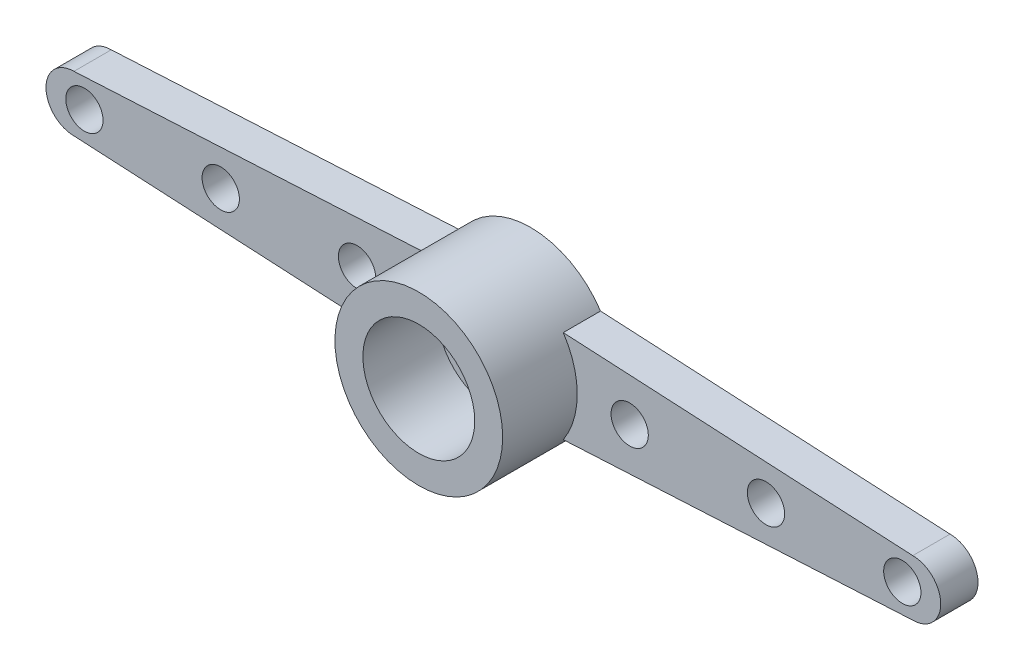
from build123d import *

# Parameters (mm, degrees)
SKETCH1_R           = 1.5
SKETCH1_R_2         = 4.5
BOSS_EXTRUDE1_DEPTH = 6
CUT_EXTRUDE1_START  = -4
SKETCH3_R           = 3
CUT_EXTRUDE1_DEPTH  = 4
SKETCH4_R           = 1
CUT_EXTRUDE2_DEPTH  = 10


with BuildPart() as part:
    # Sketch1 → Boss-Extrude1 (new body)
    with BuildSketch(Plane.XY):
        with Locations((-22.5, 0)):
            Circle(SKETCH1_R)
        with BuildLine():
            Line((-3.75, 2.487468593), (-22.5, 1.5))
            ThreePointArc((-22.5, 1.5), (-21.439339828, 1.060660172), (-21, 0))
            ThreePointArc((-21, 0), (-21.439339828, -1.060660172), (-22.5, -1.5))
            Line((-22.5, -1.5), (-3.75, -2.487468593))
            ThreePointArc((-3.75, -2.487468593), (-4.5, 0), (-3.75, 2.487468593))
        make_face()
        Circle(SKETCH1_R_2)
        with BuildLine():
            ThreePointArc((22.5, -1.5), (21, 0), (22.5, 1.5))
            Line((22.5, 1.5), (3.75, 2.487468593))
            ThreePointArc((3.75, 2.487468593), (4.308421985, 1.299038106), (4.5, 0))
            ThreePointArc((4.5, 0), (4.308421985, -1.299038106), (3.75, -2.487468593))
            Line((3.75, -2.487468593), (22.5, -1.5))
        make_face()
        with Locations((22.5, 0)):
            Circle(SKETCH1_R)
    extrude(amount=BOSS_EXTRUDE1_DEPTH)

    # Sketch3 → Cut-Extrude1 (cut)
    with BuildSketch(Plane.XY.offset(6).offset(CUT_EXTRUDE1_START)):
        with BuildLine():
            ThreePointArc((-22.5, 1.5), (-24, 0), (-22.5, -1.5))
            Line((-22.5, -1.5), (-3.75, -2.487468593))
            ThreePointArc((-3.75, -2.487468593), (-4.5, 0), (-3.75, 2.487468593))
            Line((-3.75, 2.487468593), (-22.5, 1.5))
        make_face()
        with BuildLine():
            ThreePointArc((4.5, 0), (4.308421985, -1.299038106), (3.75, -2.487468593))
            Line((3.75, -2.487468593), (22.5, -1.5))
            ThreePointArc((22.5, -1.5), (24, 0), (22.5, 1.5))
            Line((22.5, 1.5), (3.75, 2.487468593))
            ThreePointArc((3.75, 2.487468593), (4.308421985, 1.299038106), (4.5, 0))
        make_face()
        Circle(SKETCH3_R)
    extrude(amount=CUT_EXTRUDE1_DEPTH, mode=Mode.SUBTRACT)

    # Sketch4 → Cut-Extrude2 (cut)
    with BuildSketch(Plane(origin=(0, 0, 0), x_dir=(-1, 0, 0), z_dir=(0, 0, -1))):
        Circle(SKETCH4_R)
        with Locations((7.312902248, 0)):
            Circle(SKETCH4_R)
        with Locations((14.625804497, 0)):
            Circle(SKETCH4_R)
        with Locations((21.938706745, 0)):
            Circle(SKETCH4_R)
    cut_extrude2 = extrude(amount=-CUT_EXTRUDE2_DEPTH, mode=Mode.SUBTRACT)

    # Mirror1: Cut-Extrude2 across plane
    add(cut_extrude2.mirror(Plane(origin=(0, 0, 0), x_dir=(0, 0, 1), z_dir=(1, 0, 0))), mode=Mode.SUBTRACT)


solid = part.part
